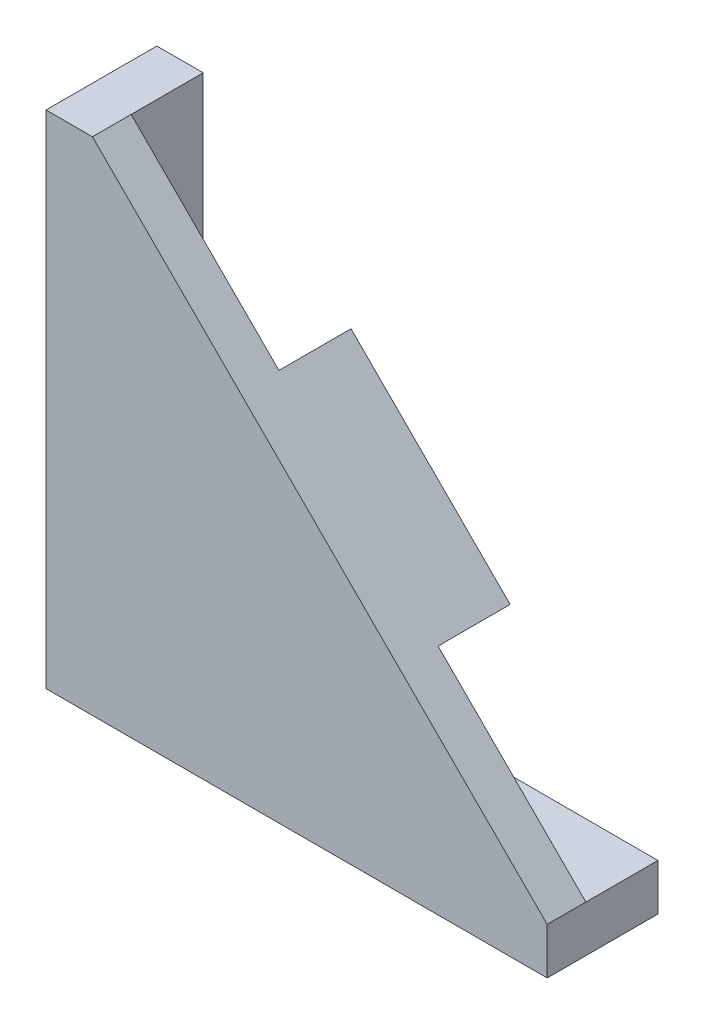
from build123d import *

# Parameters (mm, degrees)
BOSS_EXTRUDE1_DEPTH = 3.15
CUT_EXTRUDE1_DEPTH  = 2.05
BOSS_EXTRUDE2_DEPTH = 2.05


with BuildPart() as part:
    # Sketch1 → Boss-Extrude1 (new body)
    with BuildSketch(Plane.XY):
        Polygon((0, 0), (14.25, 0), (14.25, 1.32), (1.32, 14.25), (0, 14.25), align=None)
    extrude(amount=-BOSS_EXTRUDE1_DEPTH)

    # Sketch2 → Cut-Extrude1 (cut)
    with BuildSketch(Plane(origin=(0, 0, -3.15), x_dir=(-1, 0, 0), z_dir=(0, 0, -1))):
        Polygon((-14.25, 1.32), (-1.32, 1.32), (-1.32, 14.25), align=None)
    extrude(amount=-CUT_EXTRUDE1_DEPTH, mode=Mode.SUBTRACT)

    # Sketch3 → Boss-Extrude2 (add)
    with BuildSketch(Plane(origin=(0, 0, -1.1), x_dir=(-1, 0, 0), z_dir=(0, 0, -1))):
        with BuildLine():
            Line((-10.0477417, 5.5222583), (-5.5222583, 10.0477417))
            ThreePointArc((-5.5222583, 10.0477417), (-5.5222583, 5.5222583), (-10.0477417, 5.5222583))
        make_face()
        with BuildLine():
            Line((-8.659427284, 5.496359153), (-5.496359153, 8.659427284))
            ThreePointArc((-5.496359153, 8.659427284), (-6.052588386, 6.052588386), (-8.659427284, 5.496359153))
        make_face(mode=Mode.SUBTRACT)
    extrude(amount=BOSS_EXTRUDE2_DEPTH)


solid = part.part
